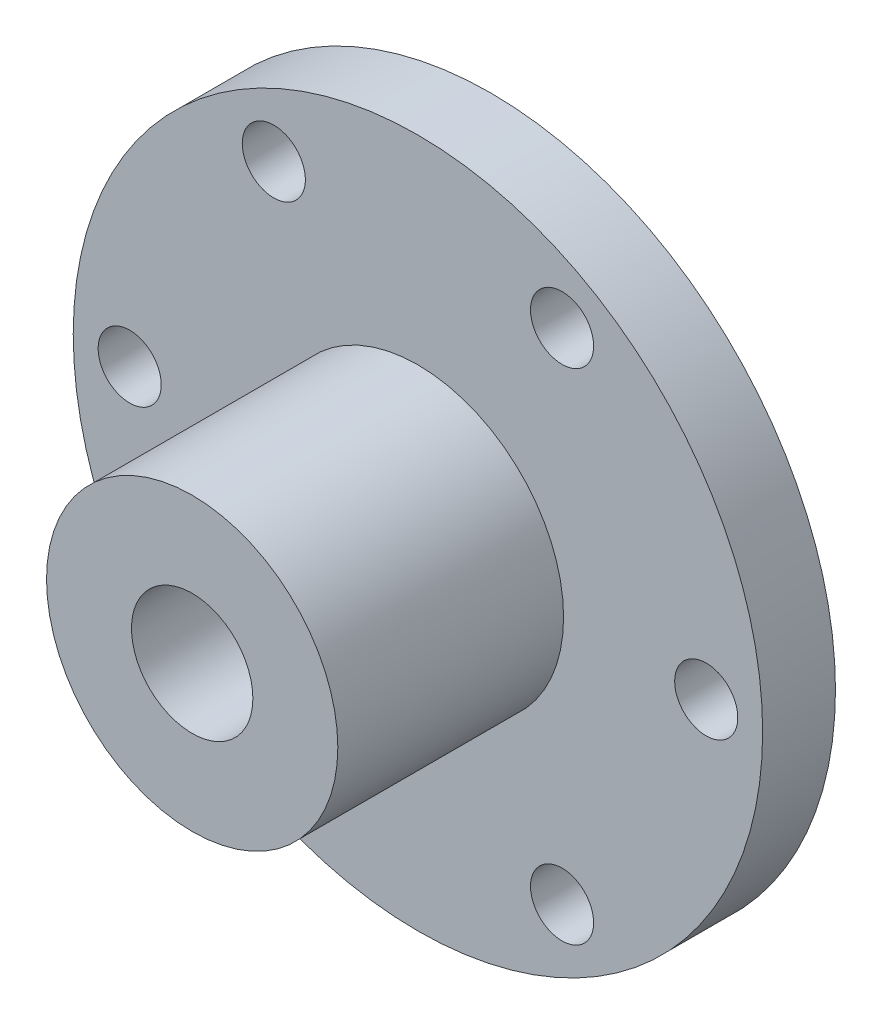
from build123d import *

# Parameters (mm, degrees)
SKETCH2_R               = 2.6
CUT_EXTRUDE1_DEPTH      = 48.098619937
CUT_EXTRUDE2_REACH      = 49.099
CUT_EXTRUDE2_END_RADIUS = 12
SKETCH3_R               = 2.75


with BuildPart() as part:
    # Sketch1 → Revolve1 (revolve)
    with BuildSketch(Plane(origin=(0, 0, 0), x_dir=(1, 0, 0), z_dir=(0, 1, 0)), mode=Mode.PRIVATE) as revolve1_sk:
        Polygon((-5, 24.6), (-28.4, 24.6), (-28.4, 18.6), (-12, 18.6), (-12, 0), (-5, 0), align=None)
    revolve(revolve1_sk.sketch.rotate(Axis((0, 0, 0), (0, 0, -1)), 180), axis=Axis((0, 0, 0), (0, 0, -1)))

    # Sketch2 → Cut-Extrude1 (cut, through all)
    with BuildSketch(Plane(origin=(0, 0, -24.6), x_dir=(-1, 0, 0), z_dir=(0, 0, -1))):
        with Locations((-23.75, 0)):
            Circle(SKETCH2_R)
        with Locations((-11.875, 20.56810334)):
            Circle(SKETCH2_R)
        with Locations((11.875, 20.56810334)):
            Circle(SKETCH2_R)
        with Locations((23.75, 0)):
            Circle(SKETCH2_R)
        with Locations((11.875, -20.56810334)):
            Circle(SKETCH2_R)
        with Locations((-11.875, -20.56810334)):
            Circle(SKETCH2_R)
    extrude(amount=-CUT_EXTRUDE1_DEPTH, mode=Mode.SUBTRACT)

    # Cut-Extrude2: up to this cylinder (the profile starts inside it)
    cut_extrude2_end = Plane(origin=(0, 0, -10.2), z_dir=(0, 0, 1)) * Cylinder(CUT_EXTRUDE2_END_RADIUS, 123.198, mode=Mode.PRIVATE)
    # Sketch3 → Cut-Extrude2 (cut, up to the surface)
    with BuildSketch(Plane(origin=(0, 0, 0), x_dir=(1, 0, 0), z_dir=(0, 1, 0)), mode=Mode.PRIVATE) as cut_extrude2_sk1:
        with Locations(Location((0, 10.2, 0), (0, 0, 270))):
            Circle(SKETCH3_R)
    cut_extrude2_tool1 = extrude(cut_extrude2_sk1.sketch, amount=-CUT_EXTRUDE2_REACH, mode=Mode.PRIVATE) & cut_extrude2_end
    add(cut_extrude2_tool1.solids().sort_by_distance((0, 0, -10.2))[0], mode=Mode.SUBTRACT)


solid = part.part
